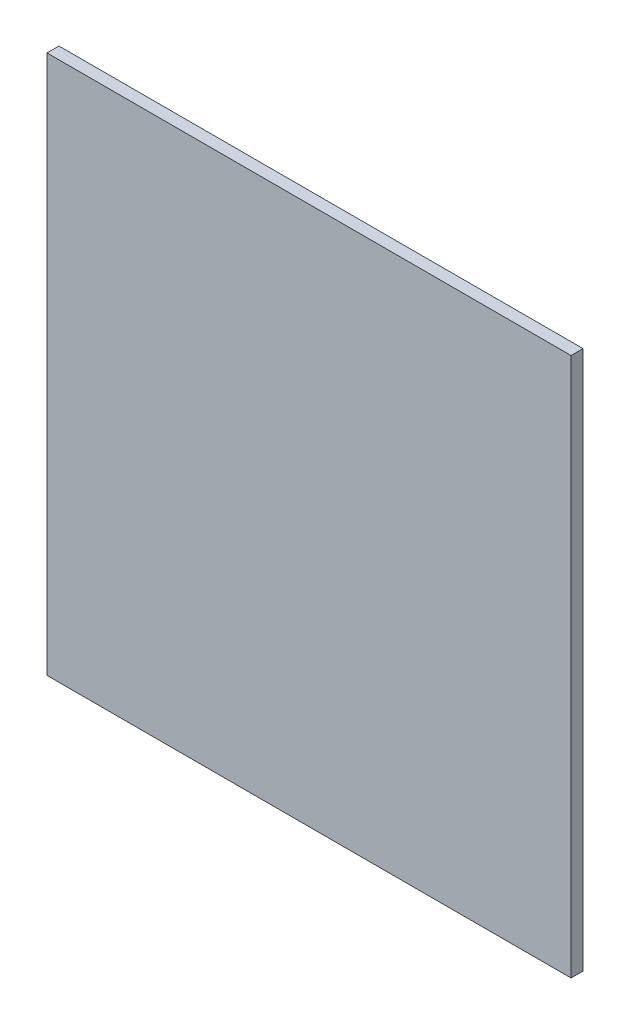
from build123d import *

# Parameters (mm, degrees)
SKETCH_1_W      = 175
SKETCH_1_H      = 180
EXTRUDE_1_DEPTH = 4


with BuildPart() as part:
    # 草图1 → 凸台-拉伸1 (new body)
    with BuildSketch(Plane.XY):
        Rectangle(SKETCH_1_W, SKETCH_1_H)
    extrude(amount=EXTRUDE_1_DEPTH)


solid = part.part
